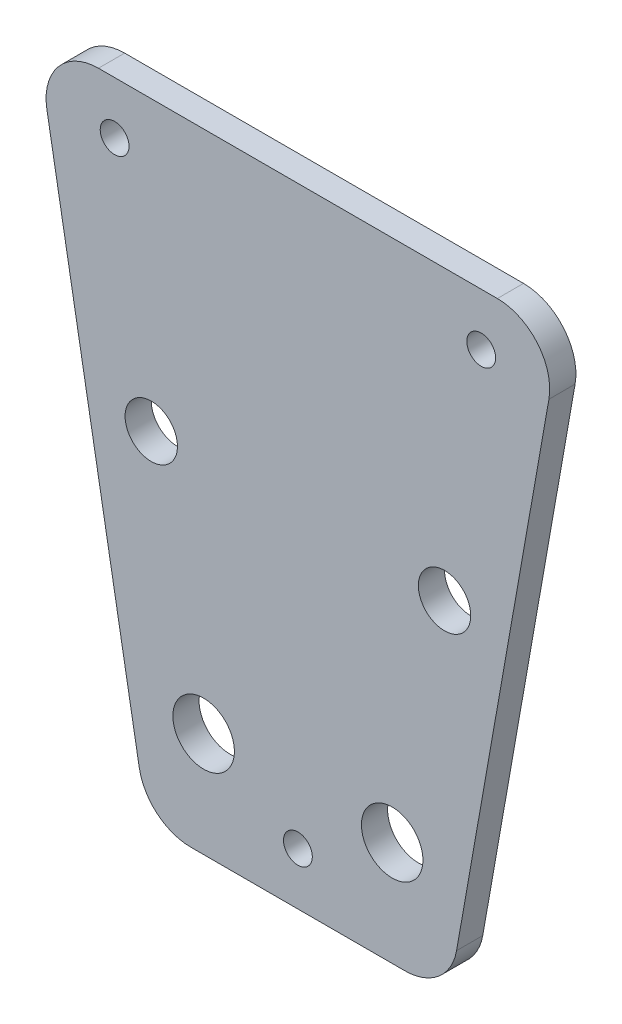
from build123d import *

# Parameters (mm, degrees)
SKETCH1_R           = 5
SKETCH1_R_2         = 5.873519116
SKETCH1_R_3         = 2.75
BOSS_EXTRUDE1_DEPTH = 2.5


with BuildPart() as part:
    # Sketch1 → Boss-Extrude1 (new, symmetric)
    with BuildSketch(Plane.XY):
        with BuildLine():
            Line((-20.449003688, 0), (20.449003688, 0))
            ThreePointArc((20.449003688, 0), (26.876879785, 2.339555569), (30.297081218, 8.263518223))
            Line((30.297081218, 8.263518223), (47.929779289, 108.263518223))
            ThreePointArc((47.929779289, 108.263518223), (45.74214619, 116.427876097), (38.081701759, 120))
            Line((38.081701759, 120), (-38.081701759, 120))
            ThreePointArc((-38.081701759, 120), (-45.74214619, 116.427876097), (-47.929779289, 108.263518223))
            Line((-47.929779289, 108.263518223), (-30.297081218, 8.263518223))
            ThreePointArc((-30.297081218, 8.263518223), (-26.876879785, 2.339555569), (-20.449003688, 0))
        make_face()
        with Locations((28, 65)):
            Circle(SKETCH1_R, mode=Mode.SUBTRACT)
        with Locations((18, 20)):
            Circle(SKETCH1_R_2, mode=Mode.SUBTRACT)
        with Locations((0, 10)):
            Circle(SKETCH1_R_3, mode=Mode.SUBTRACT)
        with Locations((35, 110)):
            Circle(SKETCH1_R_3, mode=Mode.SUBTRACT)
        with Locations(Location((-18, 20, 0), (0, 0, 180))):
            Circle(SKETCH1_R_2, mode=Mode.SUBTRACT)
        with Locations(Location((-28, 65, 0), (0, 0, 180))):
            Circle(SKETCH1_R, mode=Mode.SUBTRACT)
        with Locations(Location((-35, 110, 0), (0, 0, 180))):
            Circle(SKETCH1_R_3, mode=Mode.SUBTRACT)
    extrude(amount=BOSS_EXTRUDE1_DEPTH, both=True)


solid = part.part
